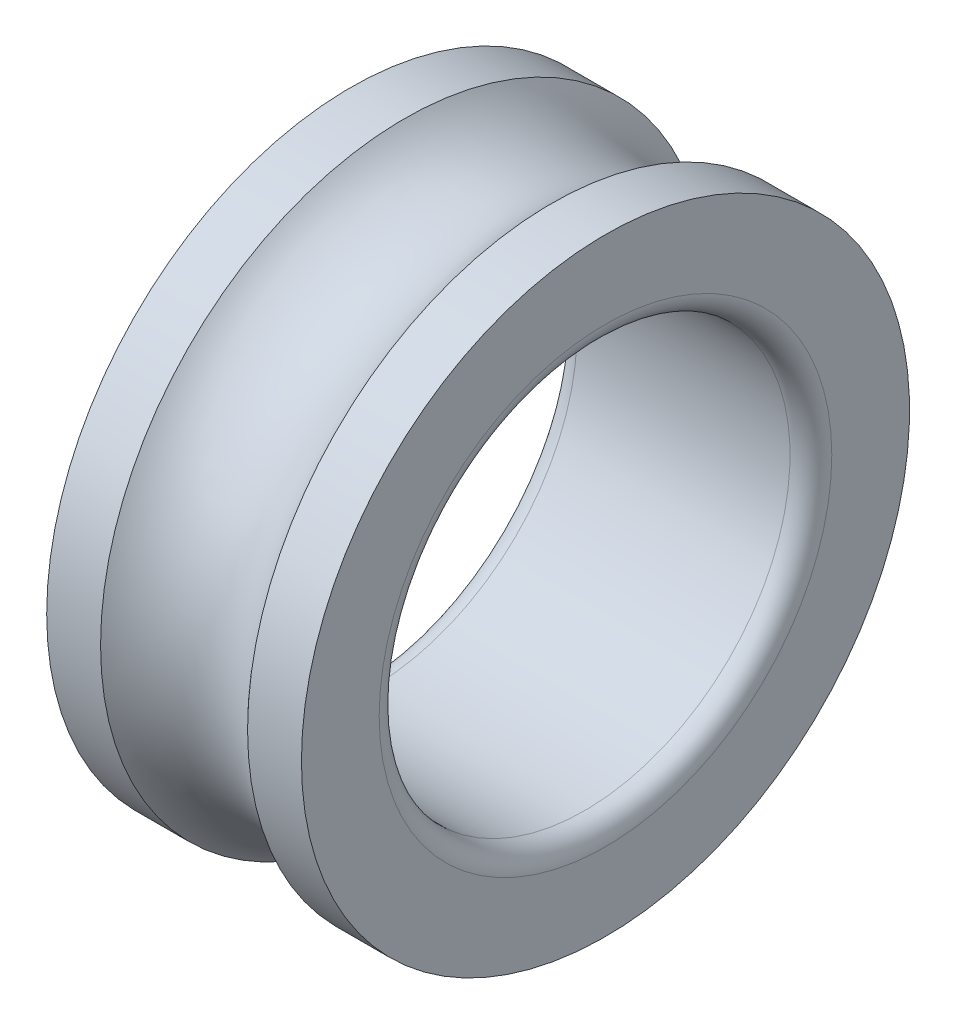
from build123d import *

# Parameters (mm, degrees)
SCALE1_SCALE = 1.41361111


with BuildPart() as part:
    # Sketch1 → Revolve1 (revolve)
    with BuildSketch(Plane.XY, mode=Mode.PRIVATE) as revolve1_sk:
        with BuildLine():
            Line((-15.5, 37), (-8.94427191, 37))
            ThreePointArc((-8.94427191, 37), (0, 33), (8.94427191, 37))
            Line((8.94427191, 37), (15.5, 37))
            Line((15.5, 37), (15.5, 27.54))
            ThreePointArc((15.5, 27.54), (14.756051224, 25.743948776), (12.96, 25))
            Line((12.96, 25), (-12.96, 25))
            ThreePointArc((-12.96, 25), (-14.756051224, 25.743948776), (-15.5, 27.54))
            Line((-15.5, 27.54), (-15.5, 37))
        make_face()
    revolve(revolve1_sk.sketch.rotate(Axis((-21.666666667, 0, 0), (1, 0, 0)), 90), axis=Axis((-21.666666667, 0, 0), (1, 0, 0)))


with BuildPart() as part_1:
    # Scale1: scaled about (0, 0, 0)
    add(part.part.scale(SCALE1_SCALE))


solid = part_1.part
